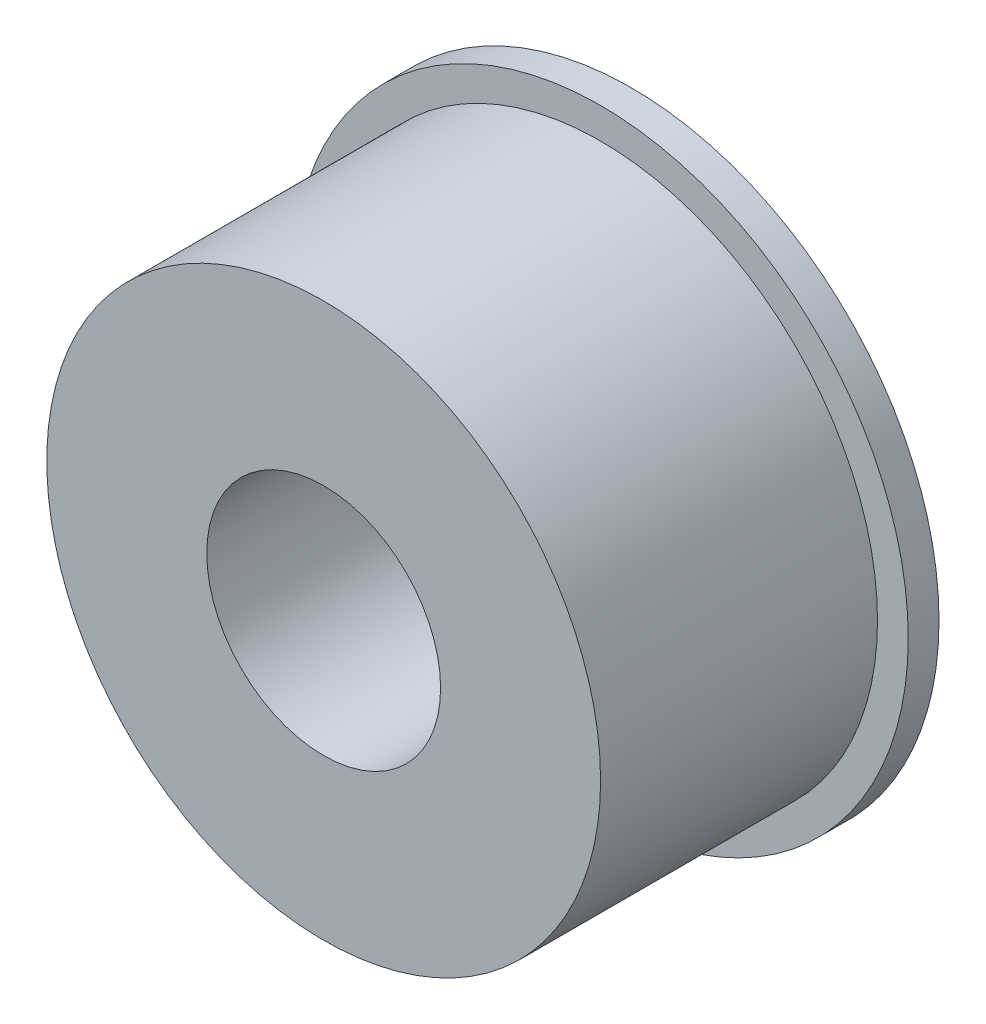
from build123d import *

# Parameters (mm, degrees)
SKETCH1_R           = 25.4
BOSS_EXTRUDE1_DEPTH = 2.54
SKETCH2_R           = 22.86
BOSS_EXTRUDE2_DEPTH = 22.86
SKETCH3_R           = 9.652
CUT_EXTRUDE1_DEPTH  = 30.734


with BuildPart() as part:
    # Sketch1 → Boss-Extrude1 (new body)
    with BuildSketch(Plane.XY):
        Circle(SKETCH1_R)
    extrude(amount=BOSS_EXTRUDE1_DEPTH)

    # Sketch2 → Boss-Extrude2 (add)
    with BuildSketch(Plane.XY.offset(2.54)):
        Circle(SKETCH2_R)
    extrude(amount=BOSS_EXTRUDE2_DEPTH)

    # Sketch3 → Cut-Extrude1 (cut)
    with BuildSketch(Plane.XY.offset(25.4)):
        Circle(SKETCH3_R)
    extrude(amount=-CUT_EXTRUDE1_DEPTH, mode=Mode.SUBTRACT)


solid = part.part
